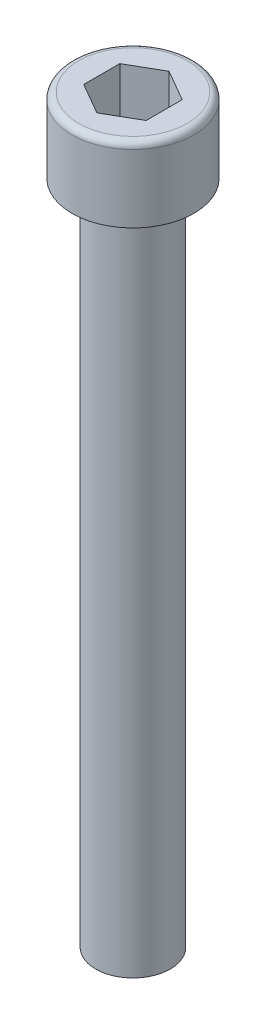
from build123d import *

# Parameters (mm, degrees)
SKETCH1_R   = 1.4224
SHAFT_DEPTH = 25.4
SKETCH2_R   = 2.3241
HEAD_DEPTH  = 2.8448
FILLET1_R   = 0.254
HEX_2_DEPTH = 1.905


with BuildPart() as part:
    # Sketch1 → Shaft (new body)
    with BuildSketch(Plane(origin=(0, 0, 0), x_dir=(1, 0, 0), z_dir=(0, 1, 0))):
        with Locations(Location((0, 0, 0), (0, 0, 270))):
            Circle(SKETCH1_R)
    extrude(amount=-SHAFT_DEPTH)

    # Sketch2 → Head (add)
    with BuildSketch(Plane(origin=(0, 0, 0), x_dir=(1, 0, 0), z_dir=(0, 1, 0))):
        with Locations(Location((0, 0, 0), (0, 0, 270))):
            Circle(SKETCH2_R)
    extrude(amount=HEAD_DEPTH)

    # Fillet1
    fillet1_edges = [part.edges().sort_by_distance(p)[0] for p in [
        (0, 2.8448, -2.3241),
    ]]
    fillet(fillet1_edges, radius=FILLET1_R)

    # Sketch3 → Hex 2 (cut)
    with BuildSketch(Plane(origin=(0, 2.8448, 0), x_dir=(1, 0, 0), z_dir=(0, 1, 0))):
        Polygon((0, 1.374815329), (-1.190625, 0.687407664), (-1.190625, -0.687407664), (0, -1.374815329), (1.190625, -0.687407664), (1.190625, 0.687407664), align=None)
    extrude(amount=-HEX_2_DEPTH, mode=Mode.SUBTRACT)


solid = part.part
